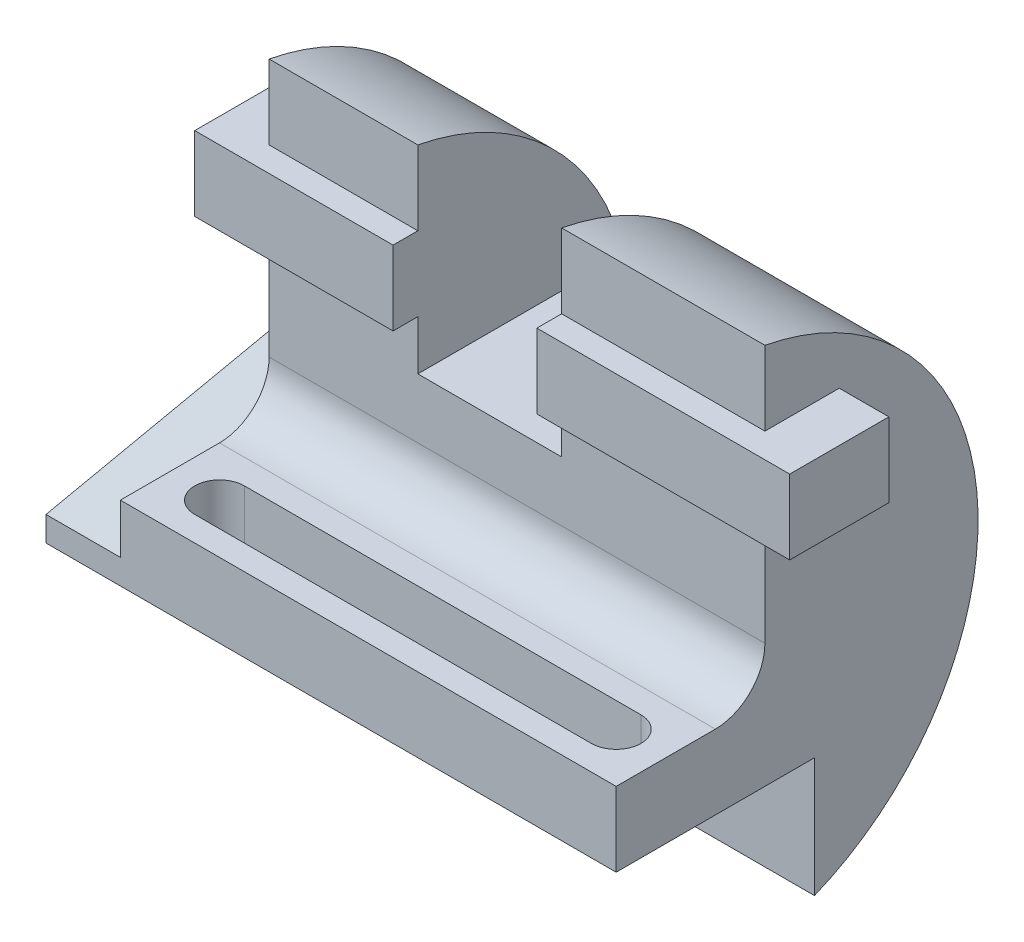
from build123d import *

# Parameters (mm, degrees)
BOSS_EXTRUDE1_DEPTH      = 57.5
BOSS_EXTRUDE1_DEPTH_BACK = 42.5
BOSS_EXTRUDE2_DEPTH      = 67.5
BOSS_EXTRUDE2_DEPTH_BACK = 52.5
SKETCH2_W                = 20
SKETCH2_H                = 15
BOSS_EXTRUDE3_START      = 15
BOSS_EXTRUDE3_DEPTH      = 15
CUT_EXTRUDE1_DEPTH       = 106.901893724
CUT_EXTRUDE2_DEPTH       = 101.370563414
CUT_EXTRUDE2_DEPTH_BACK  = 101.370563414
SKETCH5_W                = 29
SKETCH5_H                = 40


with BuildPart() as part:
    # Sketch1 → Boss-Extrude1 (new, two sides: drawn at the far end of the back side and taken through both)
    with BuildSketch(Plane(origin=(0, 0, 0), x_dir=(0, 0, -1), z_dir=(1, 0, 0)).offset(-BOSS_EXTRUDE1_DEPTH_BACK)):
        with BuildLine():
            Line((0, -10), (-20, -10))
            Line((-20, -10), (-20, -25))
            Line((-20, -25), (20, -25))
            Line((20, -25), (20, -49.081564767))
            ThreePointArc((20, -49.081564767), (52.742771868, 5.215363425), (10, 52.048054719))
            Line((10, 52.048054719), (10, 0))
            ThreePointArc((10, 0), (7.071067812, -7.071067812), (0, -10))
        make_face()
    extrude(amount=BOSS_EXTRUDE1_DEPTH + BOSS_EXTRUDE1_DEPTH_BACK)

    # Sketch2 → Boss-Extrude2 (add, two sides: drawn at the far end of the back side and taken through both)
    with BuildSketch(Plane(origin=(0, 0, 0), x_dir=(0, 0, -1), z_dir=(1, 0, 0)).offset(-BOSS_EXTRUDE2_DEPTH_BACK)):
        with Locations((15, 29.548054719)):
            Rectangle(SKETCH2_W, SKETCH2_H)
    extrude(amount=BOSS_EXTRUDE2_DEPTH + BOSS_EXTRUDE2_DEPTH_BACK)

    # Sketch3 → Boss-Extrude3 (add)
    with BuildSketch(Plane.ZY.offset(42.5).offset(BOSS_EXTRUDE3_START)):
        with BuildLine():
            Line((20, -25), (-20, -25))
            Line((-20, -25), (-20, -49.081564767))
            ThreePointArc((-20, -49.081564767), (-42.679392836, -31.424026273), (-52.80652364, -4.524495668))
            Line((-52.80652364, -4.524495668), (20, -20))
            Line((20, -20), (20, -25))
        make_face()
    extrude(amount=-BOSS_EXTRUDE3_DEPTH)

    # Sketch4 → Cut-Extrude1 (cut, through all)
    with BuildSketch(Plane(origin=(0, -10, 0), x_dir=(1, 0, 0), z_dir=(0, 1, 0))):
        with BuildLine():
            Line((-32.5, -5), (47.5, -5))
            ThreePointArc((47.5, -5), (52.5, -10), (47.5, -15))
            Line((47.5, -15), (-32.5, -15))
            ThreePointArc((-32.5, -15), (-37.5, -10), (-32.5, -5))
        make_face()
    extrude(amount=-CUT_EXTRUDE1_DEPTH, mode=Mode.SUBTRACT)

    # Sketch5 → Cut-Extrude2 (cut, two sides: drawn at the far end of the back side and taken through both)
    with BuildSketch(Plane.XY.offset(-CUT_EXTRUDE2_DEPTH_BACK)):
        with Locations((2, 32.048054719)):
            Rectangle(SKETCH5_W, SKETCH5_H)
    extrude(amount=CUT_EXTRUDE2_DEPTH + CUT_EXTRUDE2_DEPTH_BACK, mode=Mode.SUBTRACT)


solid = part.part
